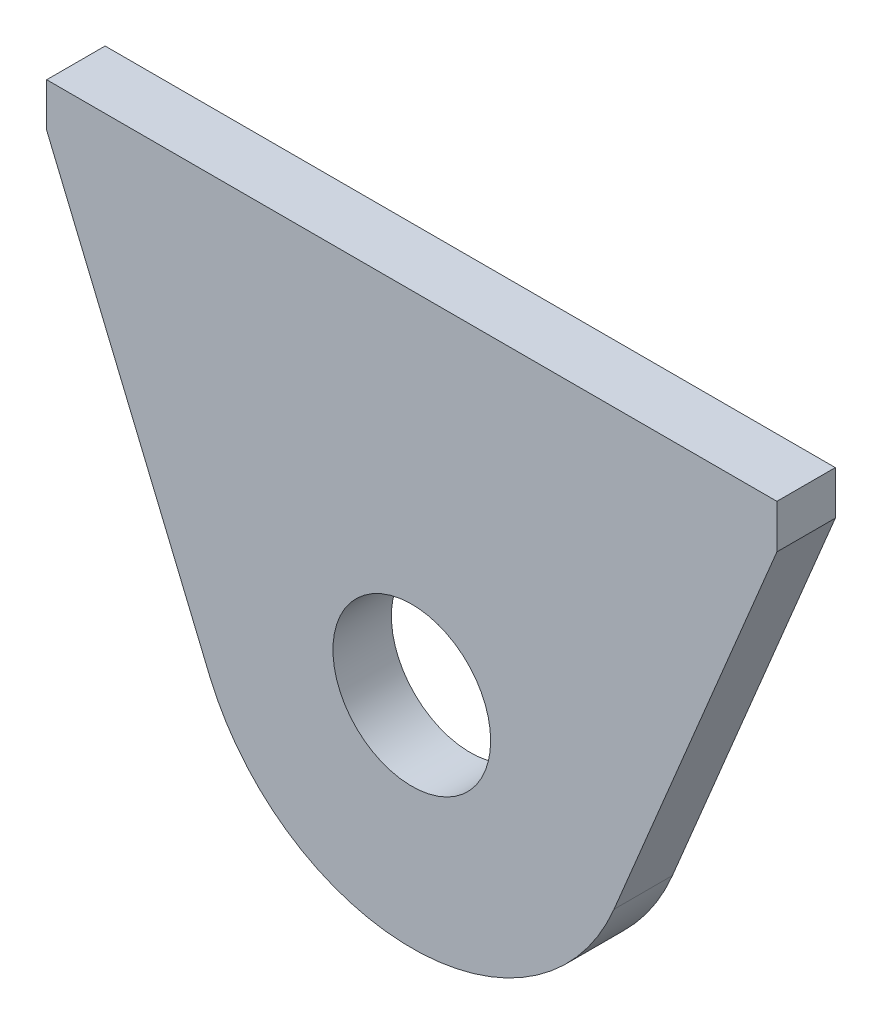
from build123d import *

# Parameters (mm, degrees)
SKETCH_1_R      = 5.4
EXTRUDE_1_DEPTH = 4


with BuildPart() as part:
    # Эскиз1 → Бобышка-Вытянуть1 (new body)
    with BuildSketch(Plane.XY):
        with BuildLine():
            Line((-25, 24), (25, 24))
            Line((25, 24), (25, 21))
            Line((25, 21), (13.846153846, -5.769230769))
            ThreePointArc((13.846153846, -5.769230769), (0, -15), (-13.846153846, -5.769230769))
            Line((-13.846153846, -5.769230769), (-25, 21))
            Line((-25, 21), (-25, 24))
        make_face()
        Circle(SKETCH_1_R, mode=Mode.SUBTRACT)
    extrude(amount=EXTRUDE_1_DEPTH)


solid = part.part
